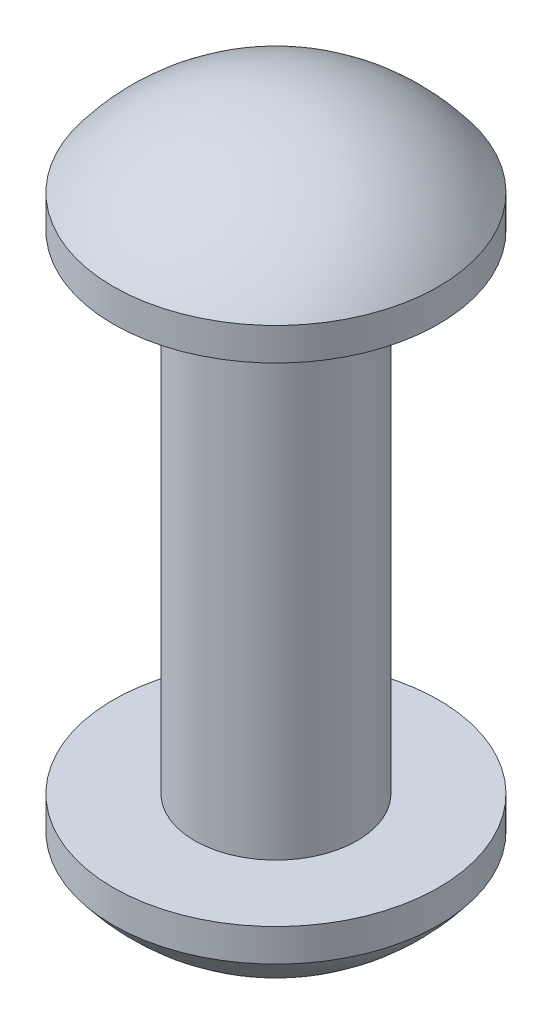
from build123d import *

# Parameters (mm, degrees)
SKETCH_1_R                  = 3
EXTRUDE_1_DEPTH             = 9
SKETCH_2_R                  = 6
EXTRUDE_2_DEPTH             = 1.2
DOME_1_FACE_RADIUS          = 6
DOME_1_HEIGHT               = 3
MIRROR_1_COPY_1_FACE_RADIUS = 6
MIRROR_1_COPY_1_HEIGHT      = 3


with BuildPart() as part:
    # Эскиз1 → Бобышка-Вытянуть1 (new, symmetric)
    with BuildSketch(Plane(origin=(0, 0, 0), x_dir=(1, 0, 0), z_dir=(0, 1, 0))):
        with Locations(Location((0, 0, 0), (0, 0, 270))):
            Circle(SKETCH_1_R)
    extrude(amount=EXTRUDE_1_DEPTH, both=True)

    # Эскиз2 → Бобышка-Вытянуть2 (add)
    with BuildSketch(Plane(origin=(0, 9, 0), x_dir=(1, 0, 0), z_dir=(0, 1, 0))):
        with Locations(Location((0, 0, 0), (0, 0, 270))):
            Circle(SKETCH_2_R)
    extrude_2 = extrude(amount=EXTRUDE_2_DEPTH)

    # Купол1: a dome of height H over a round flat face of radius A is a cap of a sphere of radius (A * A + H * H) / (2 * H)
    dome_1_r = (DOME_1_FACE_RADIUS * DOME_1_FACE_RADIUS + DOME_1_HEIGHT * DOME_1_HEIGHT) / (2 * DOME_1_HEIGHT)
    dome_1_base = Plane((0, 10.2, 0), z_dir=(0, 1, 0))
    with Locations(dome_1_base.offset(DOME_1_HEIGHT - dome_1_r)):
        dome_1_ball = Sphere(dome_1_r, mode=Mode.PRIVATE)
    add(split(dome_1_ball, bisect_by=dome_1_base, keep=Keep.TOP, mode=Mode.PRIVATE))

    # Зеркальное отражение1: Бобышка-Вытянуть2 across plane
    add(extrude_2.mirror(Plane.ZX))

    # Зеркальное отражение1 copy 1: a dome of height H over a round flat face of radius A is a cap of a sphere of radius (A * A + H * H) / (2 * H)
    mirror_1_copy_1_r = (MIRROR_1_COPY_1_FACE_RADIUS * MIRROR_1_COPY_1_FACE_RADIUS + MIRROR_1_COPY_1_HEIGHT * MIRROR_1_COPY_1_HEIGHT) / (2 * MIRROR_1_COPY_1_HEIGHT)
    mirror_1_copy_1_base = Plane((0, -10.2, 0), z_dir=(0, -1, 0))
    with Locations(mirror_1_copy_1_base.offset(MIRROR_1_COPY_1_HEIGHT - mirror_1_copy_1_r)):
        mirror_1_copy_1_ball = Sphere(mirror_1_copy_1_r, mode=Mode.PRIVATE)
    add(split(mirror_1_copy_1_ball, bisect_by=mirror_1_copy_1_base, keep=Keep.TOP, mode=Mode.PRIVATE))


solid = part.part
